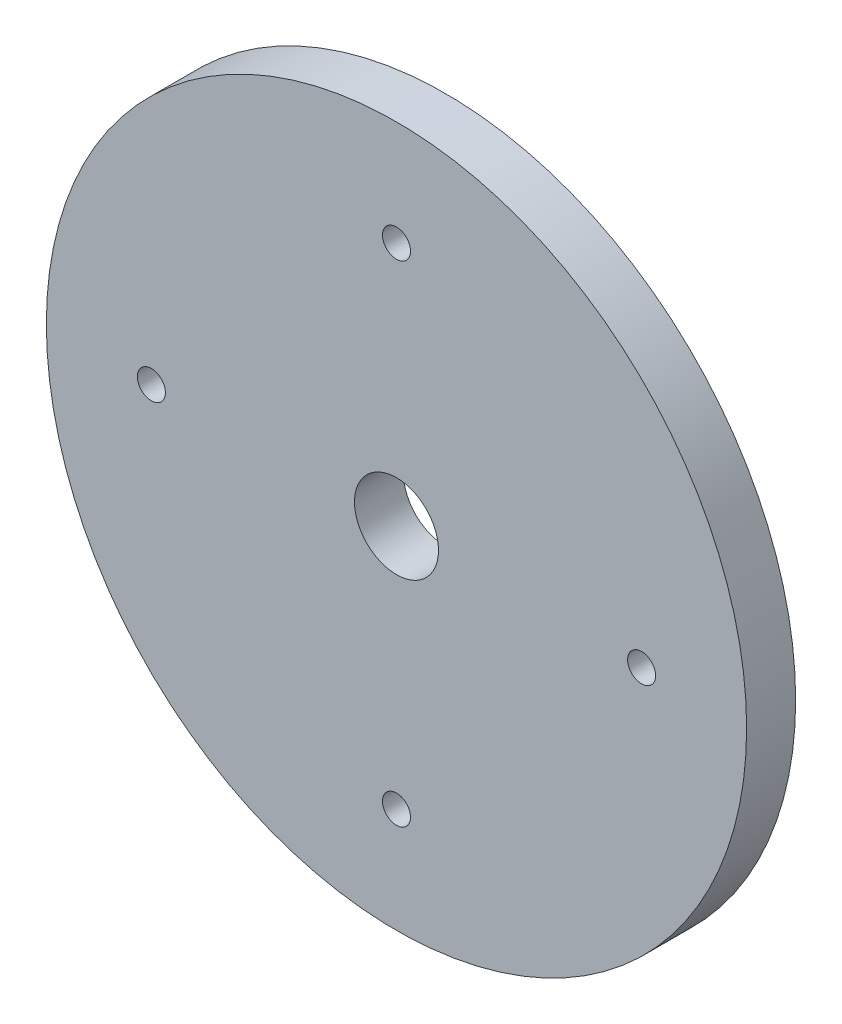
from build123d import *

# Parameters (mm, degrees)
SKETCH1_R           = 50
SKETCH1_R_2         = 6
BOSS_EXTRUDE1_DEPTH = 7
SKETCH2_R           = 2
CUT_EXTRUDE1_DEPTH  = 72.056315694


with BuildPart() as part:
    # Sketch1 → Boss-Extrude1 (new body)
    with BuildSketch(Plane.XY):
        Circle(SKETCH1_R)
        Circle(SKETCH1_R_2, mode=Mode.SUBTRACT)
    extrude(amount=BOSS_EXTRUDE1_DEPTH)

    # Sketch2 → Cut-Extrude1 (cut, through all)
    with BuildSketch(Plane.XY.offset(7)):
        with Locations((0, 35)):
            Circle(SKETCH2_R)
        with Locations((0, -35)):
            Circle(SKETCH2_R)
        with Locations((-35, 0)):
            Circle(SKETCH2_R)
        with Locations((35, 0)):
            Circle(SKETCH2_R)
    extrude(amount=-CUT_EXTRUDE1_DEPTH, mode=Mode.SUBTRACT)


solid = part.part
